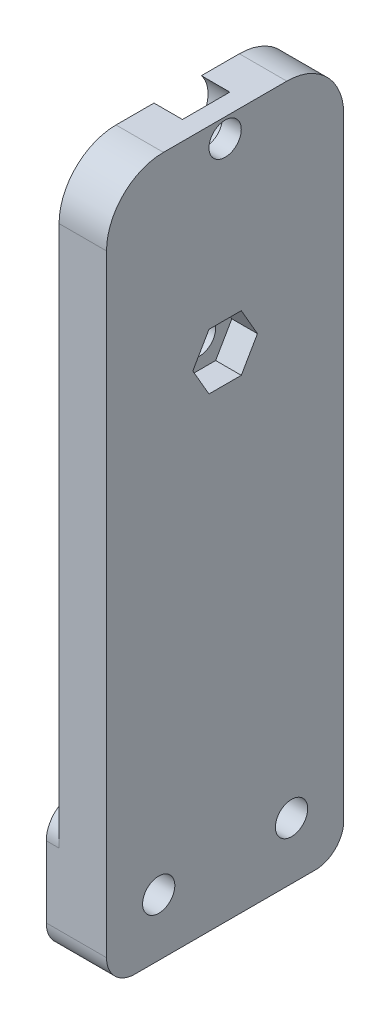
from build123d import *

# Parameters (mm, degrees)
COVER_START       = -26.9
COVER_PLATE_DEPTH = 5
TAIL_START        = -28.25
TAIL_PAD_DEPTH    = 1.55
PIN_START         = -27.1
SKETCH3_R         = 7.25
PIN_SEAT_DEPTH    = 1.2
BOLT_START        = -28.55
SKETCH4_R         = 1.7
BOLT_HOLES_DEPTH  = 6.85
PIN_START_2       = -24.6
PIN_NUT_DEPTH     = 2.9
COUNTERBORE_START = -27.1
SKETCH6_R         = 3.2
COUNTERBORE_DEPTH = 3.2


with BuildPart() as part:
    # Sketch1 → Cover plate (new body)
    with BuildSketch(Plane(origin=(0, 0, 0), x_dir=(0, 0, -1), z_dir=(1, 0, 0)).offset(COVER_START)):
        with BuildLine():
            Line((-1.5, 271.5), (-1.5, 336))
            ThreePointArc((-1.5, 336), (-3.257359313, 340.242640687), (-7.5, 342))
            Line((-7.5, 342), (-20.5, 342))
            ThreePointArc((-20.5, 342), (-24.742640687, 340.242640687), (-26.5, 336))
            Line((-26.5, 336), (-26.5, 271.5))
            ThreePointArc((-26.5, 271.5), (-25.621320344, 269.378679656), (-23.5, 268.5))
            Line((-23.5, 268.5), (-4.5, 268.5))
            ThreePointArc((-4.5, 268.5), (-2.378679656, 269.378679656), (-1.5, 271.5))
        make_face()
    extrude(amount=COVER_PLATE_DEPTH)

    # Sketch2 → Tail pad (add)
    with BuildSketch(Plane(origin=(0, 0, 0), x_dir=(0, 0, -1), z_dir=(1, 0, 0)).offset(TAIL_START)):
        with BuildLine():
            Line((-1.5, 271.5), (-1.5, 279))
            ThreePointArc((-1.5, 279), (-2.378679656, 281.121320344), (-4.5, 282))
            Line((-4.5, 282), (-23.5, 282))
            ThreePointArc((-23.5, 282), (-25.621320344, 281.121320344), (-26.5, 279))
            Line((-26.5, 279), (-26.5, 271.5))
            ThreePointArc((-26.5, 271.5), (-25.621320344, 269.378679656), (-23.5, 268.5))
            Line((-23.5, 268.5), (-4.5, 268.5))
            ThreePointArc((-4.5, 268.5), (-2.378679656, 269.378679656), (-1.5, 271.5))
        make_face()
    extrude(amount=TAIL_PAD_DEPTH)

    # Sketch3 → Pin seat (cut)
    with BuildSketch(Plane(origin=(0, 0, 0), x_dir=(0, 0, -1), z_dir=(1, 0, 0)).offset(PIN_START)):
        with Locations((-14, 320.5)):
            Circle(SKETCH3_R)
    extrude(amount=PIN_SEAT_DEPTH, mode=Mode.SUBTRACT)

    # Sketch4 → Bolt holes (cut)
    with BuildSketch(Plane(origin=(0, 0, 0), x_dir=(0, 0, -1), z_dir=(1, 0, 0)).offset(BOLT_START)):
        with Locations((-14, 320.5)):
            Circle(SKETCH4_R)
        with Locations((-7, 274.5)):
            Circle(SKETCH4_R)
        with Locations((-21, 274.5)):
            Circle(SKETCH4_R)
        with Locations((-14, 340)):
            Circle(SKETCH4_R)
    extrude(amount=BOLT_HOLES_DEPTH, mode=Mode.SUBTRACT)

    # Sketch5 → Pin nut (cut)
    with BuildSketch(Plane(origin=(0, 0, 0), x_dir=(0, 0, -1), z_dir=(1, 0, 0)).offset(PIN_START_2)):
        Polygon((-15.703183294, 323.45), (-17.406366588, 320.5), (-15.703183294, 317.55), (-12.296816706, 317.55), (-10.593633412, 320.5), (-12.296816706, 323.45), align=None)
    extrude(amount=PIN_NUT_DEPTH, mode=Mode.SUBTRACT)

    # Sketch6 → Counterbore (cut)
    with BuildSketch(Plane(origin=(0, 0, 0), x_dir=(0, 0, -1), z_dir=(1, 0, 0)).offset(COUNTERBORE_START)):
        with Locations((-14, 340)):
            Circle(SKETCH6_R)
    extrude(amount=COUNTERBORE_DEPTH, mode=Mode.SUBTRACT)


solid = part.part
